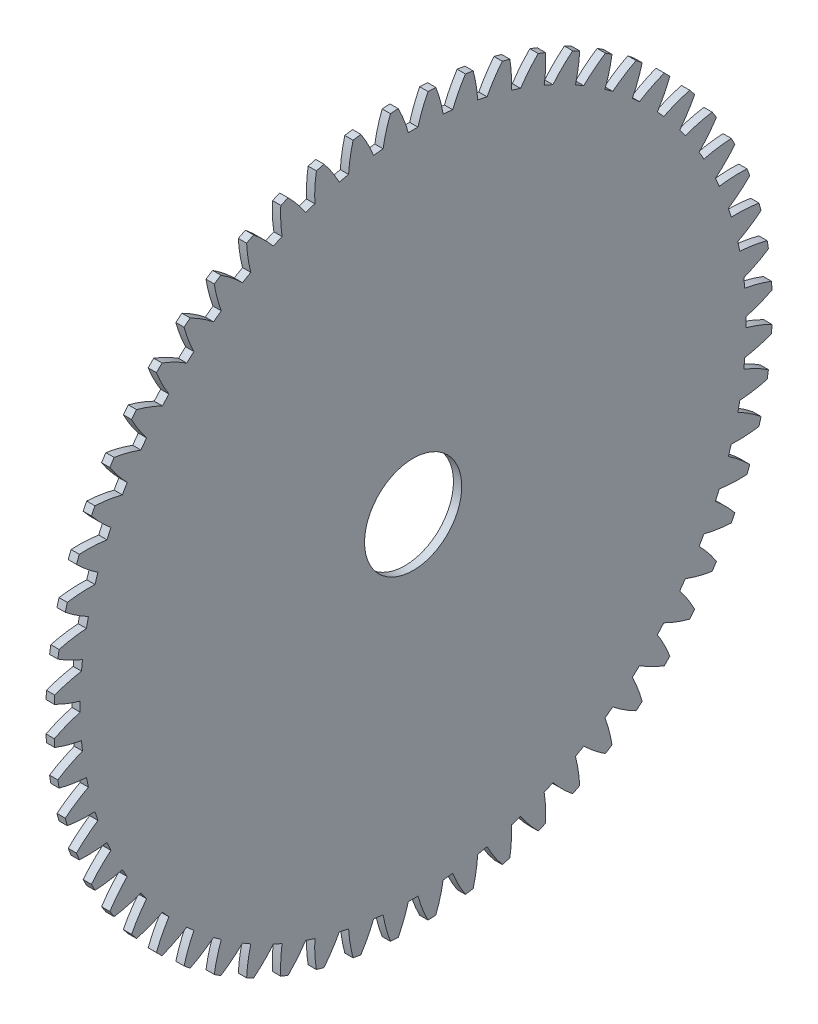
from build123d import *

# Parameters (mm, degrees)
BASPROSKE_W     = 0.2
BASPROSKE_H     = 8.68
TOOTHCUT_DEPTH  = 13.277002892
TEETHCUTS_COUNT = 60
TEETHCUTS_ANGLE = 354
BORSKE_R        = 1.175
BORE_DEPTH      = 50.0000508


with BuildPart() as part:
    # BasProSke → Base-Revolve (revolve)
    with BuildSketch(Plane(origin=(0, 0, 0), x_dir=(1, 0, 0), z_dir=(0, 1, 0)), mode=Mode.PRIVATE) as base_revolve_sk:
        with Locations((0.1, 4.34)):
            Rectangle(BASPROSKE_W, BASPROSKE_H)
    revolve(base_revolve_sk.sketch.rotate(Axis((-10, 0, 0), (1, 0, 0)), 180), axis=Axis((-10, 0, 0), (1, 0, 0)))

    # TooCutSke → ToothCut (cut, through all)
    with BuildSketch(Plane(origin=(0, 0, 0), x_dir=(0, 0, -1), z_dir=(1, 0, 0))):
        with BuildLine():
            ThreePointArc((0.115814417, 8.048166749), (0, 8.049), (-0.115814417, 8.048166749))
            ThreePointArc((-0.115814417, 8.048166749), (-0.227017396, 8.379478158), (-0.372032154, 8.697446823))
            ThreePointArc((-0.372032154, 8.697446823), (0, 8.7054), (0.372032154, 8.697446823))
            ThreePointArc((0.372032154, 8.697446823), (0.227017396, 8.379478158), (0.115814417, 8.048166749))
        make_face()
    toothcut = extrude(amount=TOOTHCUT_DEPTH, mode=Mode.SUBTRACT)

    # TeethCuts: ToothCut ×60 about axis
    teethcuts_axis = Axis((-10, 0, 0), (1, 0, 0))
    for i in range(1, TEETHCUTS_COUNT):
        add(toothcut.rotate(teethcuts_axis, i * TEETHCUTS_ANGLE / (TEETHCUTS_COUNT - 1)), mode=Mode.SUBTRACT)

    # BorSke → Bore (cut, symmetric)
    with BuildSketch(Plane(origin=(0, 0, 0), x_dir=(0, 0, -1), z_dir=(1, 0, 0))):
        with Locations(Location((0, 0, 0), (0, 0, 180))):
            Circle(BORSKE_R)
    extrude(amount=BORE_DEPTH, both=True, mode=Mode.SUBTRACT)


solid = part.part
